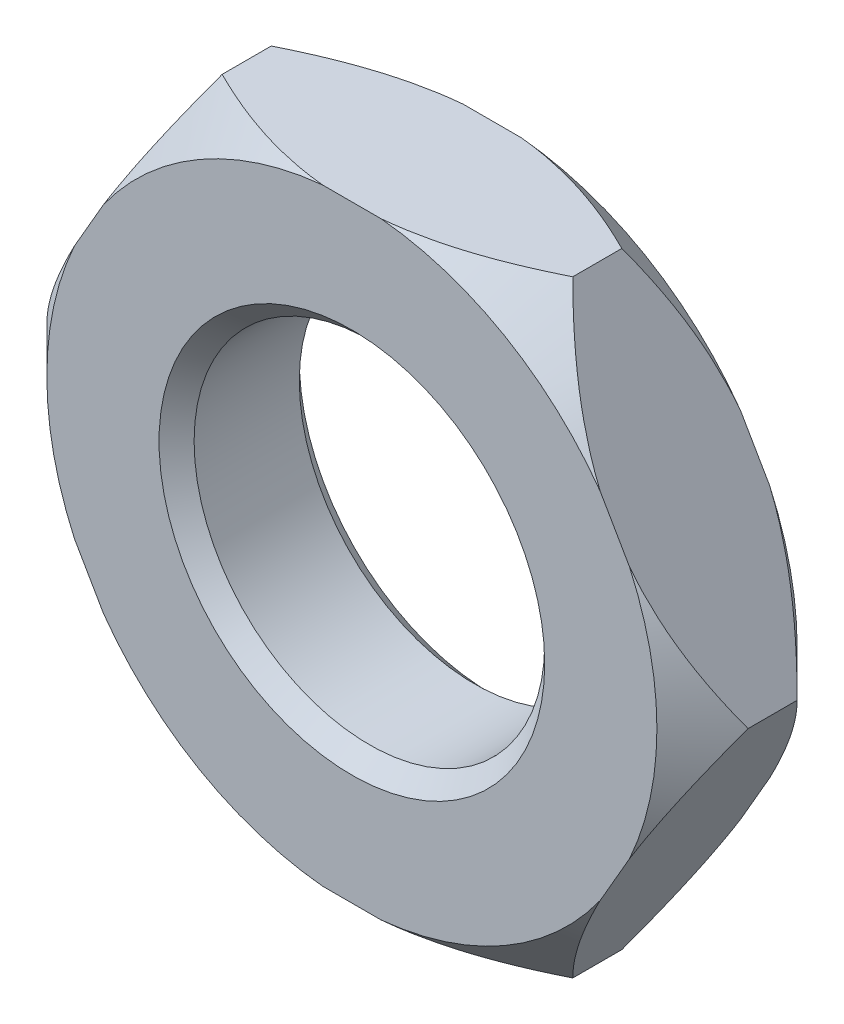
from build123d import *

# Parameters (mm, degrees)
BOSS_EXTRUDE1_DEPTH = 2
SKETCH2_R           = 5
CUT_EXTRUDE1_DEPTH  = 14.820274961
CHAMFER1_SIZE       = 0.5


with BuildPart() as part:
    # Sketch1 → Boss-Extrude1 (new, symmetric)
    with BuildSketch(Plane.XY):
        Polygon((-10, 0), (-5, -8.660254038), (5, -8.660254038), (10, 0), (5, 8.660254038), (-5, 8.660254038), align=None)
    extrude(amount=BOSS_EXTRUDE1_DEPTH, both=True)

    # Sketch2 → Cut-Extrude1 (cut, through all)
    with BuildSketch(Plane.XY.offset(-2)):
        Circle(SKETCH2_R)
    extrude(amount=CUT_EXTRUDE1_DEPTH, mode=Mode.SUBTRACT)

    # Sketch8 → Cut-Revolve1 (revolve, cut)
    with BuildSketch(Plane(origin=(0, 0, 0), x_dir=(1, 0, 0), z_dir=(0, 1, 0))):
        Polygon((-8.6, -2.1), (-10.1, -2.1), (-10.1, -0.6), align=None)
    cut_revolve1 = revolve(axis=Axis((0, 0, -7.705), (0, 0, 1)), mode=Mode.SUBTRACT)

    # Mirror1: Cut-Revolve1 across plane
    add(cut_revolve1.mirror(Plane.XY), mode=Mode.SUBTRACT)

    # Chamfer1
    chamfer1_edges = [part.edges().sort_by_distance(p)[0] for p in [
        (-5, 0, -2),
        (-5, 0, 2),
    ]]
    chamfer(chamfer1_edges, length=CHAMFER1_SIZE)


solid = part.part
